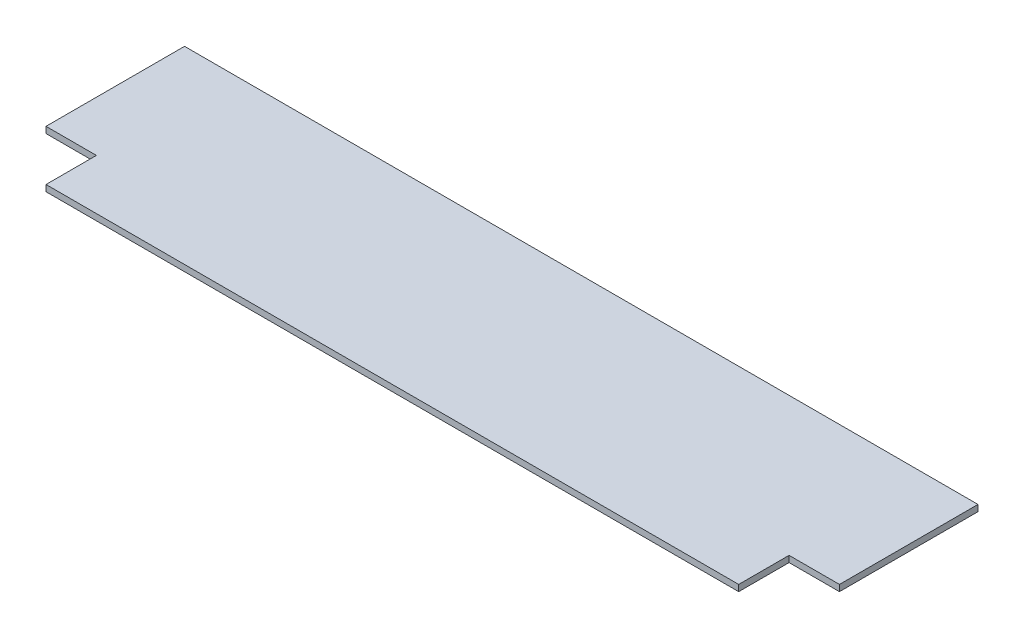
from build123d import *

# Parameters (mm, degrees)
SKETCH1_W           = 800.1
SKETCH1_H           = 190.5
BOSS_EXTRUDE1_DEPTH = 6.35
SKETCH2_W           = 50.8
SKETCH2_H           = 50.8
CUT_EXTRUDE1_DEPTH  = 412.282004834


with BuildPart() as part:
    # Sketch1 → Boss-Extrude1 (new body)
    with BuildSketch(Plane(origin=(0, 0, 0), x_dir=(1, 0, 0), z_dir=(0, 1, 0))):
        Rectangle(SKETCH1_W, SKETCH1_H)
    extrude(amount=BOSS_EXTRUDE1_DEPTH)

    # Sketch2 → Cut-Extrude1 (cut, through all)
    with BuildSketch(Plane(origin=(0, 6.35, 0), x_dir=(1, 0, 0), z_dir=(0, 1, 0))):
        with Locations((374.65, -69.85)):
            Rectangle(SKETCH2_W, SKETCH2_H)
        with Locations((-374.65, -69.85)):
            Rectangle(SKETCH2_W, SKETCH2_H)
    extrude(amount=-CUT_EXTRUDE1_DEPTH, mode=Mode.SUBTRACT)


solid = part.part
